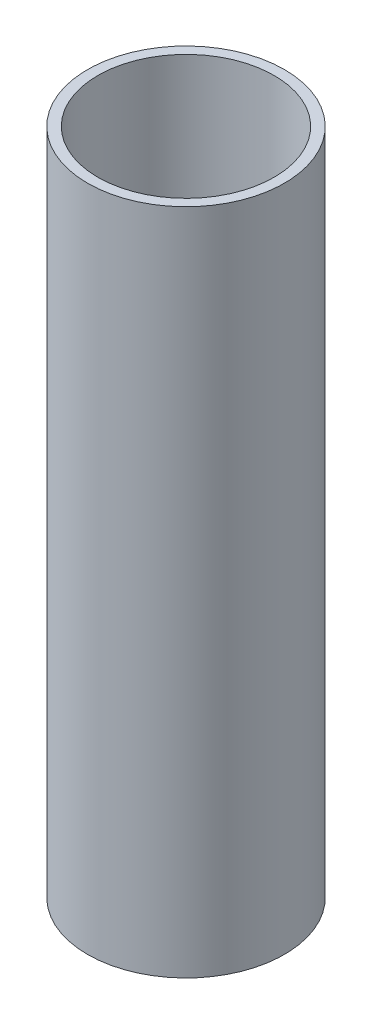
from build123d import *

# Parameters (mm, degrees)
SKETCH1_R           = 19.163369398
SKETCH1_R_2         = 17.163369398
BOSS_EXTRUDE1_DEPTH = 65


with BuildPart() as part:
    # Sketch1 → Boss-Extrude1 (new, symmetric)
    with BuildSketch(Plane(origin=(0, 0, 0), x_dir=(1, 0, 0), z_dir=(0, 1, 0))):
        with Locations(Location((-4.129636555, 1.391251354, 0), (0, 0, 270))):
            Circle(SKETCH1_R)
        with Locations(Location((-4.129636555, 1.391251354, 0), (0, 0, 270))):
            Circle(SKETCH1_R_2, mode=Mode.SUBTRACT)
    extrude(amount=BOSS_EXTRUDE1_DEPTH, both=True)


solid = part.part
